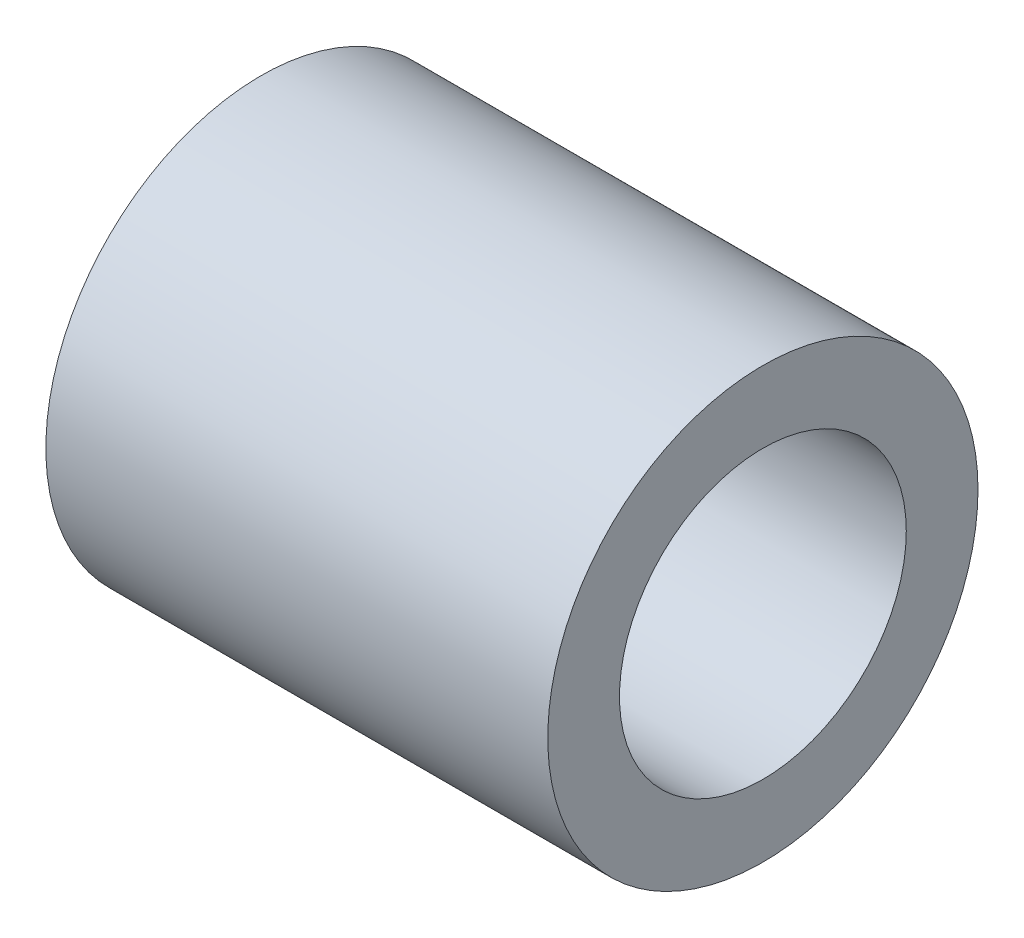
from build123d import *

# Parameters (mm, degrees)
CROQUIS1_R              = 0.375
CROQUIS1_R_2            = 0.25
SALIENTE_EXTRUIR1_DEPTH = 0.875


with BuildPart() as part:
    # Croquis1 → Saliente-Extruir1 (new body)
    with BuildSketch(Plane(origin=(0, 0, 0), x_dir=(0, 0, -1), z_dir=(1, 0, 0))):
        Circle(CROQUIS1_R)
        Circle(CROQUIS1_R_2, mode=Mode.SUBTRACT)
    extrude(amount=SALIENTE_EXTRUIR1_DEPTH)


solid = part.part
